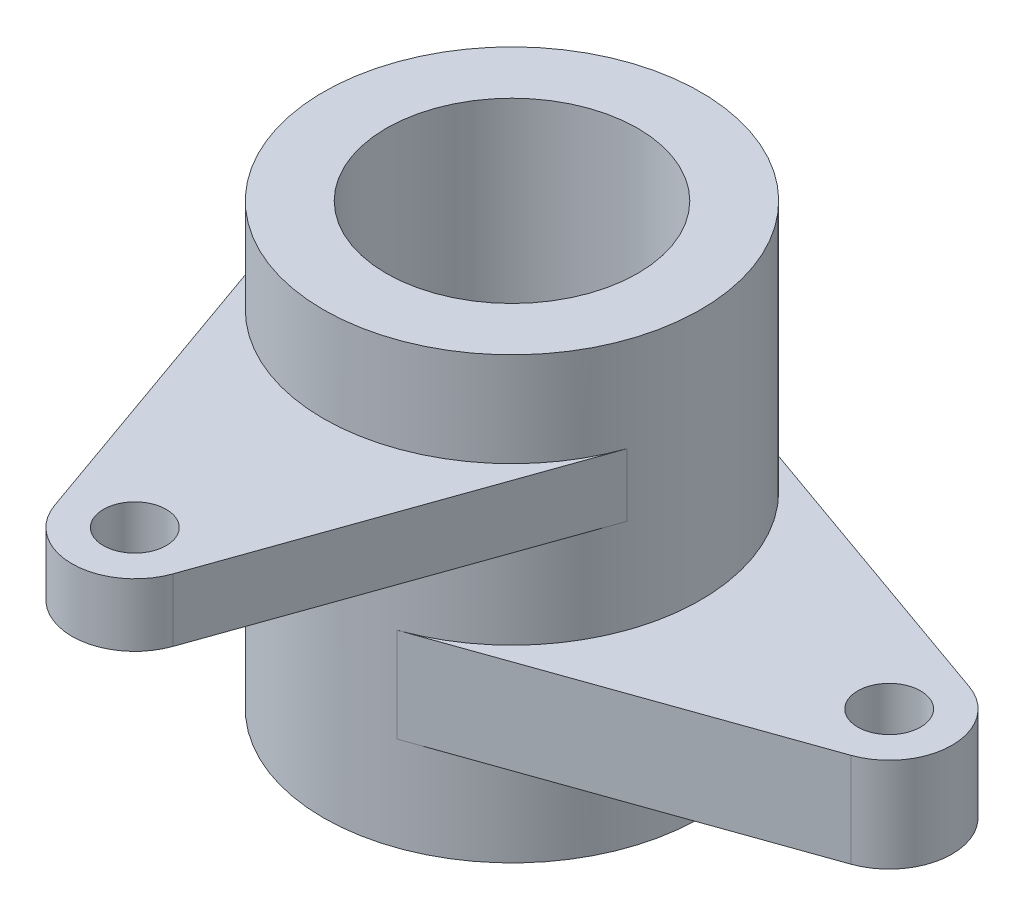
from build123d import *

# Parameters (mm, degrees)
SKETCH1_R             = 30
SKETCH1_R_2           = 20
BOSS_EXTRUDE1_DEPTH   = 70
BOSS_EXTRUDE2_START   = -15
SKETCH2_R             = 5
BOSS_EXTRUDE2_DEPTH   = 10
BOSS_EXTRUDE3_START   = -40
SKETCH2_3_R           = 5
BOSS_EXTRUDE3_DEPTH   = 15
BODY_MOVE_COPY1_ANGLE = 90


with BuildPart() as part:
    # Sketch1 → Boss-Extrude1 (new body)
    with BuildSketch(Plane(origin=(0, 0, 0), x_dir=(1, 0, 0), z_dir=(0, 1, 0))):
        Circle(SKETCH1_R)
        Circle(SKETCH1_R_2, mode=Mode.SUBTRACT)
    extrude(amount=-BOSS_EXTRUDE1_DEPTH)

    # Sketch2 → Boss-Extrude2 (add)
    with BuildSketch(Plane(origin=(0, 0, 0), x_dir=(1, 0, 0), z_dir=(0, 1, 0)).offset(BOSS_EXTRUDE2_START)):
        with BuildLine():
            ThreePointArc((28.284271247, -10), (0, -30), (-28.284271247, -10))
            Line((-28.284271247, -10), (-9.428090416, -63.333333333))
            ThreePointArc((-9.428090416, -63.333333333), (0, -70), (9.428090416, -63.333333333))
            Line((9.428090416, -63.333333333), (28.284271247, -10))
        make_face()
        with Locations((0, -60)):
            Circle(SKETCH2_R, mode=Mode.SUBTRACT)
    extrude(amount=-BOSS_EXTRUDE2_DEPTH)


with BuildPart() as body_2:
    # Sketch2<3> → Boss-Extrude3 (new body)
    with BuildSketch(Plane(origin=(0, 0, 0), x_dir=(1, 0, 0), z_dir=(0, 1, 0)).offset(BOSS_EXTRUDE3_START)):
        with BuildLine():
            ThreePointArc((28.284271247, -10), (0, -30), (-28.284271247, -10))
            Line((-28.284271247, -10), (-9.428090416, -63.333333333))
            ThreePointArc((-9.428090416, -63.333333333), (0, -70), (9.428090416, -63.333333333))
            Line((9.428090416, -63.333333333), (28.284271247, -10))
        make_face()
        with Locations((0, -60)):
            Circle(SKETCH2_3_R, mode=Mode.SUBTRACT)
    extrude(amount=-BOSS_EXTRUDE3_DEPTH)


with BuildPart() as body_2_1:
    # Body-Move/Copy1: moved
    add(body_2.part.rotate(Axis((0, 0, 0), (0, 1, 0)), BODY_MOVE_COPY1_ANGLE))


solid = Compound([part.part, body_2_1.part])
